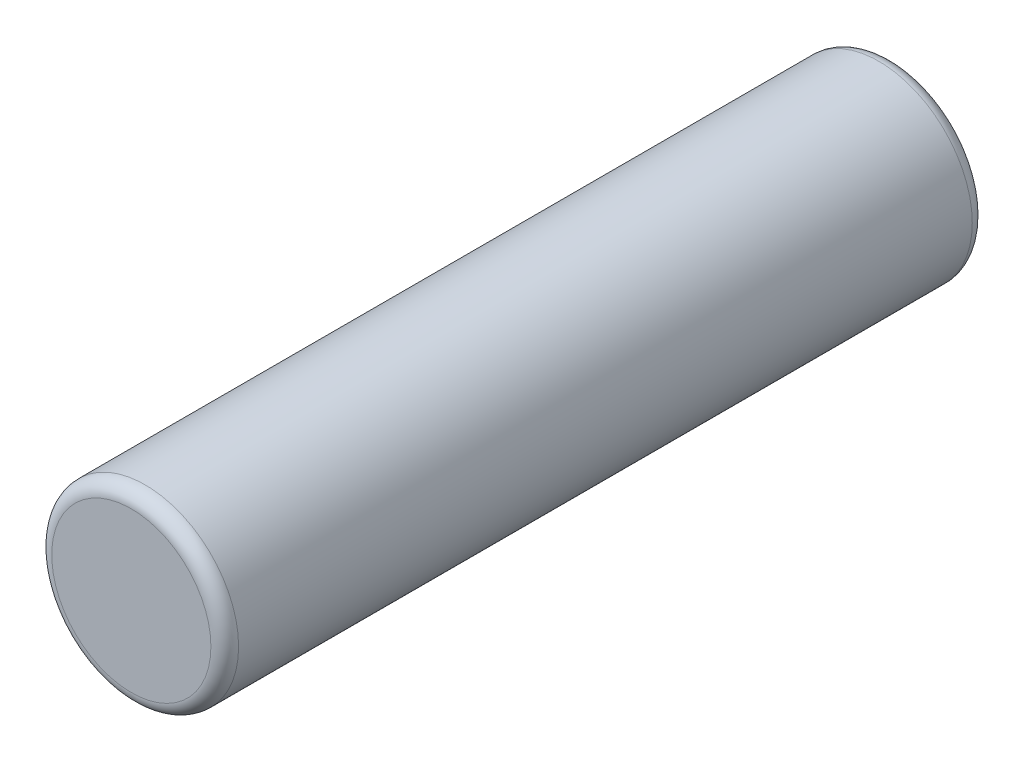
from build123d import *

# Parameters (mm, degrees)
SKETCH1_R           = 13.5
BOSS_EXTRUDE1_DEPTH = 110
FILLET1_R           = 2
FILLET2_R           = 2


with BuildPart() as part:
    # Sketch1 → Boss-Extrude1 (new body)
    with BuildSketch(Plane.XY):
        Circle(SKETCH1_R)
    extrude(amount=BOSS_EXTRUDE1_DEPTH)

    # Fillet1
    fillet1_edges = [part.edges().sort_by_distance(p)[0] for p in [
        (-13.5, 0, 110),
    ]]
    fillet(fillet1_edges, radius=FILLET1_R)

    # Fillet2
    fillet2_edges = [part.edges().sort_by_distance(p)[0] for p in [
        (-13.5, 0, 0),
    ]]
    fillet(fillet2_edges, radius=FILLET2_R)


solid = part.part
